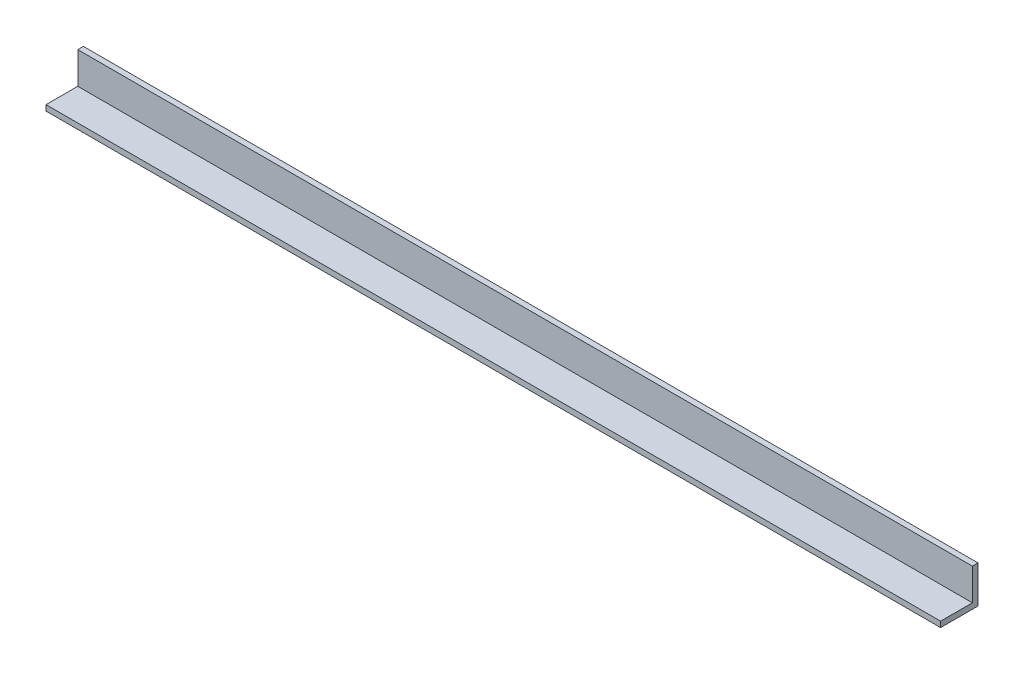
from build123d import *

# Parameters (mm, degrees)
SKETCH_1_W          = 1915
SKETCH_1_H          = 80
EXTRUDE_1_DEPTH     = 80
SKETCH_3_W          = 68
SKETCH_3_H          = 68
CUT_EXTRUDE_2_DEPTH = 1919.339125389


with BuildPart() as part:
    # 草图1 → 拉伸1 (new body)
    with BuildSketch(Plane.XY):
        with Locations((957.5, 40)):
            Rectangle(SKETCH_1_W, SKETCH_1_H)
    extrude(amount=EXTRUDE_1_DEPTH)

    # 草图3 → 拉伸2 (cut, through all)
    with BuildSketch(Plane.ZY):
        with Locations((46, 46)):
            Rectangle(SKETCH_3_W, SKETCH_3_H)
    extrude(amount=-CUT_EXTRUDE_2_DEPTH, mode=Mode.SUBTRACT)


solid = part.part
